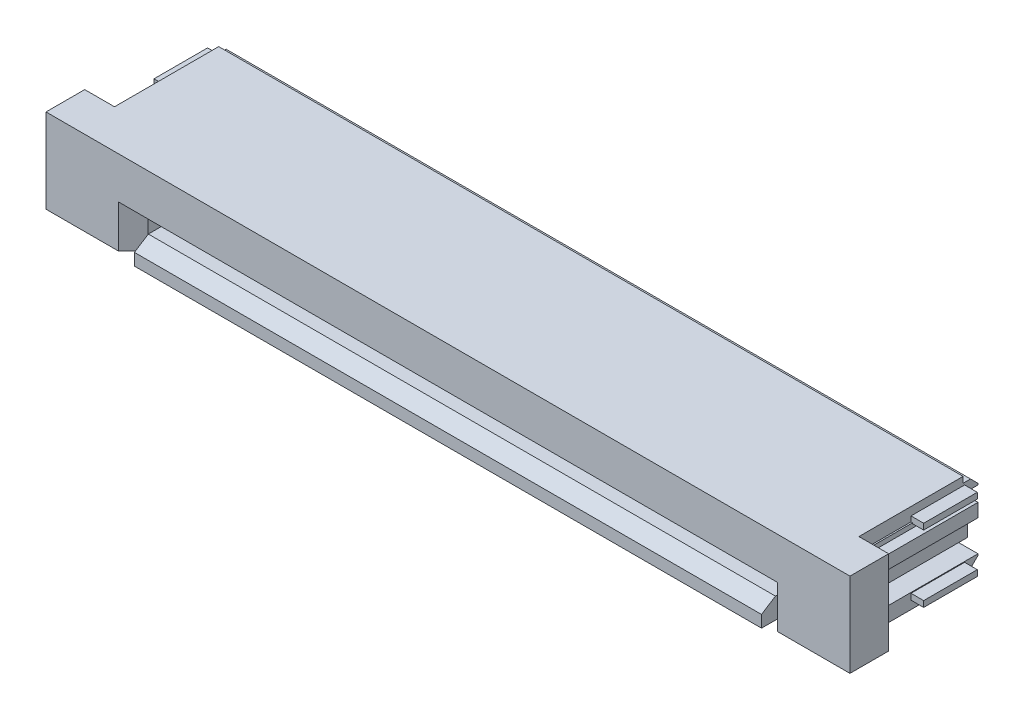
from build123d import *

# Parameters (mm, degrees)
BASE_DEPTH              = 12.5
SKETCH2_W               = 21.2
SKETCH2_H               = 1.55
CARD_SLOT_DEPTH         = 3.8
SKETCH4_W               = 1.775
SKETCH4_H               = 2
WINGS_DEPTH             = 14.209844814
FRONT_START             = -1.3
SKETCH5_W               = 1.97
SKETCH5_H               = 3
FRONT_LEAD_IN_DEPTH     = 1.3
CARD_SLOT_LEAD_IN_SIZE  = 0.1
CARD_SLOT_LEAD_IN_SIZE2 = 0.173205081
WT_DEPTH                = 1.8
GATE_DEPTH              = 1.3
GATE_CHAMFER_SIZE       = 0.5
GATE_GUIDE_DEPTH        = 3.6
F_01_CONTACT_DEPTH      = 0.125
LPATTERN3_COUNT         = 20
LPATTERN3_PITCH         = 1


with BuildPart() as part:
    # Sketch1 → Base (new, symmetric)
    with BuildSketch(Plane(origin=(0, 0, 0), x_dir=(0, 0, -1), z_dir=(1, 0, 0))):
        Polygon((-1.75, 1.5), (1.75, 1.5), (1.75, 1.3), (2, 1.3), (2.25, 1.05), (2.25, -1.05), (2, -1.3), (1.75, -1.3), (1.75, -1.5), (-3.05, -1.5), (-3.05, -1.1), (-2.35, -0.65), (-1.75, -0.65), align=None)
    extrude(amount=BASE_DEPTH, both=True)

    # Sketch2 → Card Slot (cut)
    with BuildSketch(Plane.XY.offset(3.05)):
        with Locations((0, -0.025)):
            Rectangle(SKETCH2_W, SKETCH2_H)
    extrude(amount=-CARD_SLOT_DEPTH, mode=Mode.SUBTRACT)

    # Sketch4 → Wings (cut, through all)
    with BuildSketch(Plane.XY.offset(1.75)):
        with Locations((-11.6125, 0)):
            Rectangle(SKETCH4_W, SKETCH4_H)
        with Locations((11.6125, 0)):
            Rectangle(SKETCH4_W, SKETCH4_H)
    extrude(amount=-WINGS_DEPTH, mode=Mode.SUBTRACT)

    # Sketch5 → Front Lead In (cut)
    with BuildSketch(Plane.XY.offset(3.05).offset(FRONT_START)):
        with Locations((-11.515, 0)):
            Rectangle(SKETCH5_W, SKETCH5_H)
        with Locations((11.515, 0)):
            Rectangle(SKETCH5_W, SKETCH5_H)
    extrude(amount=FRONT_LEAD_IN_DEPTH, mode=Mode.SUBTRACT)

    # Card Slot Lead In
    card_slot_lead_in_edges = [part.edges().sort_by_distance(p)[0] for p in [
        (0, 0.75, 1.75),
        (-10.6, -0.025, 1.75),
        (10.6, -0.025, 1.75),
    ]]
    card_slot_lead_in_side = [part.faces().sort_by_distance(p)[0] for p in [
        (0, 0.875692186, 1.75),
    ]]
    chamfer(card_slot_lead_in_edges, length=CARD_SLOT_LEAD_IN_SIZE, length2=CARD_SLOT_LEAD_IN_SIZE2, reference=card_slot_lead_in_side[0])

    # Sketch8 → WT (add)
    with BuildSketch(Plane.XY):
        with BuildLine():
            Line((-12.925, 1.025), (-11.075, 1.025))
            ThreePointArc((-11.075, 1.025), (-10.968933983, 0.981066017), (-10.925, 0.875))
            Line((-10.925, 0.875), (-10.925, -0.875))
            ThreePointArc((-10.925, -0.875), (-10.968933983, -0.981066017), (-11.075, -1.025))
            Line((-11.075, -1.025), (-12.925, -1.025))
            Line((-12.925, -1.025), (-12.925, -1.225))
            Line((-12.925, -1.225), (-11.075, -1.225))
            ThreePointArc((-11.075, -1.225), (-10.827512627, -1.122487373), (-10.725, -0.875))
            Line((-10.725, -0.875), (-10.725, 0.875))
            ThreePointArc((-10.725, 0.875), (-10.827512627, 1.122487373), (-11.075, 1.225))
            Line((-11.075, 1.225), (-12.925, 1.225))
            Line((-12.925, 1.225), (-12.925, 1.025))
        make_face()
        with BuildLine():
            Line((12.925, 1.025), (11.075, 1.025))
            ThreePointArc((11.075, 1.025), (10.968933983, 0.981066017), (10.925, 0.875))
            Line((10.925, 0.875), (10.925, -0.875))
            ThreePointArc((10.925, -0.875), (10.968933983, -0.981066017), (11.075, -1.025))
            Line((11.075, -1.025), (12.925, -1.025))
            Line((12.925, -1.025), (12.925, -1.225))
            Line((12.925, -1.225), (11.075, -1.225))
            ThreePointArc((11.075, -1.225), (10.827512627, -1.122487373), (10.725, -0.875))
            Line((10.725, -0.875), (10.725, 0.875))
            ThreePointArc((10.725, 0.875), (10.827512627, 1.122487373), (11.075, 1.225))
            Line((11.075, 1.225), (12.925, 1.225))
            Line((12.925, 1.225), (12.925, 1.025))
        make_face()
    extrude(amount=-WT_DEPTH)

    # Sketch9 → Gate (add)
    with BuildSketch(Plane.XY.offset(1.75)):
        Polygon((10.57, 0.1), (10.57, -1.33), (13.5, -1.33), (13.5, 1.5), (-13.5, 1.5), (-13.5, -1.33), (-10.57, -1.33), (-10.57, 0.1), align=None)
    extrude(amount=GATE_DEPTH)

    # Gate Chamfer
    gate_chamfer_edges = [part.edges().sort_by_distance(p)[0] for p in [
        (-10.57, -0.615, 3.05),
        (10.57, -0.615, 3.05),
    ]]
    chamfer(gate_chamfer_edges, length=GATE_CHAMFER_SIZE)

    # Sketch10 → Gate Guide (add)
    with BuildSketch(Plane(origin=(0, 0, 1.75), x_dir=(-1, 0, 0), z_dir=(0, 0, -1))):
        Polygon((-12.55, -0.3), (-12.55, 0.44506), (-12.9, 0.44506), (-12.9, 0.89506), (-12.55, 0.89506), (-12.55, 1.05), (-11.9, 1.05), (-11.9, 0.375499815), (-11.625, 0.375499815), (-11.625, -0.201850454), (-12, -0.201850454), (-12, -0.3), align=None)
        Polygon((11.625, -0.201850454), (11.625, 0.375499815), (11.9, 0.375499815), (11.9, 1.05), (12.55, 1.05), (12.55, 0.89506), (12.9, 0.89506), (12.9, 0.44506), (12.55, 0.44506), (12.55, -0.3), (12, -0.3), (12, -0.201850454), align=None)
    extrude(amount=GATE_GUIDE_DEPTH)

    # Sketch13 → -01 Contact (add, symmetric)
    with BuildSketch(Plane(origin=(9.5, 0, 0), x_dir=(0, 0, -1), z_dir=(1, 0, 0))):
        with BuildLine():
            ThreePointArc((1.091468707, -0.7696), (1.268245402, -0.696376695), (1.341468707, -0.5196))
            Line((1.341468707, -0.5196), (1.341468707, -0.44900832))
            ThreePointArc((1.341468707, -0.44900832), (1.111505179, 0.091419351), (0.562636527, 0.300437279))
            Line((0.562636527, 0.300437279), (-1.104507646, 0.2363))
            ThreePointArc((-1.104507646, 0.2363), (-1.202075654, 0.195944223), (-1.25, 0.101862545))
            ThreePointArc((-1.25, 0.101862545), (-1.295444824, 0.048293017), (-1.362451828, 0.069387751))
            Line((-1.362451828, 0.069387751), (-1.649820024, 0.424987751))
            ThreePointArc((-1.649820024, 0.424987751), (-1.649328111, 0.505413401), (-1.570395768, 0.520847536))
            ThreePointArc((-1.570395768, 0.520847536), (-1.36954416, 0.449036779), (-1.1564545, 0.4395))
            Line((-1.1564545, 0.4395), (1.138268707, 0.6804))
            Line((1.138268707, 0.6804), (1.551768707, 0.6804))
            ThreePointArc((1.551768707, 0.6804), (1.650551525, 0.639482817), (1.691468707, 0.5407))
            ThreePointArc((1.691468707, 0.5407), (1.830262642, 0.551847257), (1.896637232, 0.67425))
            Line((1.896637232, 0.67425), (1.896637232, 0.677234263))
            ThreePointArc((1.896637232, 0.677234263), (2.07345297, 0.85405), (2.250268707, 0.677234263))
            Line((2.250268707, 0.677234263), (2.250268707, 0.324203125))
            ThreePointArc((2.250268707, 0.324203125), (2.212168707, 0.2234), (2.250268707, 0.122596875))
            Line((2.250268707, 0.122596875), (2.250268707, -0.561796875))
            ThreePointArc((2.250268707, -0.561796875), (2.225665582, -0.725303125), (2.364568707, -0.815))
            Line((2.364568707, -0.815), (2.505907985, -0.815))
            ThreePointArc((2.505907985, -0.815), (2.630745337, -0.837012193), (2.740525462, -0.900393778))
            Line((2.740525462, -0.900393778), (3.069017668, -1.176031466))
            ThreePointArc((3.069017668, -1.176031466), (3.12631387, -1.209111444), (3.191468707, -1.2206))
            Line((3.191468707, -1.2206), (3.648668707, -1.2206))
            ThreePointArc((3.648668707, -1.2206), (3.720510756, -1.250357951), (3.750268707, -1.3222))
            Line((3.750268707, -1.3222), (3.750268707, -1.3984))
            ThreePointArc((3.750268707, -1.3984), (3.720510756, -1.470242049), (3.648668707, -1.5))
            Line((3.648668707, -1.5), (3.191468707, -1.5))
            ThreePointArc((3.191468707, -1.5), (3.030753442, -1.471661563), (2.889422809, -1.390064284))
            Line((2.889422809, -1.390064284), (2.60967503, -1.155328025))
            ThreePointArc((2.60967503, -1.155328025), (2.402653987, -1.096846191), (2.221577699, -1.21298927))
            ThreePointArc((2.221577699, -1.21298927), (2.023089184, -1.285925543), (1.896637232, -1.116434263))
            Line((1.896637232, -1.116434263), (1.896637232, -1.11345))
            ThreePointArc((1.896637232, -1.11345), (1.830262642, -0.991047257), (1.691468707, -0.9799))
            ThreePointArc((1.691468707, -0.9799), (1.650551525, -1.078682817), (1.551768707, -1.1196))
            Line((1.551768707, -1.1196), (-1.375731293, -1.1196))
            ThreePointArc((-1.375731293, -1.1196), (-1.44817573, -1.064011428), (-1.413231293, -0.979648095))
            Line((-1.413231293, -0.979648095), (-1.066821131, -0.779648095))
            ThreePointArc((-1.066821131, -0.779648095), (-1.04873256, -0.772155563), (-1.029321131, -0.7696))
            Line((-1.029321131, -0.7696), (1.091468707, -0.7696))
        make_face()
    f_01_contact = extrude(amount=F_01_CONTACT_DEPTH, both=True)

    # LPattern3: -01 Contact ×20
    with Locations(*[(-i * LPATTERN3_PITCH, 0, 0) for i in range(1, LPATTERN3_COUNT)]):
        add(f_01_contact)


solid = part.part
